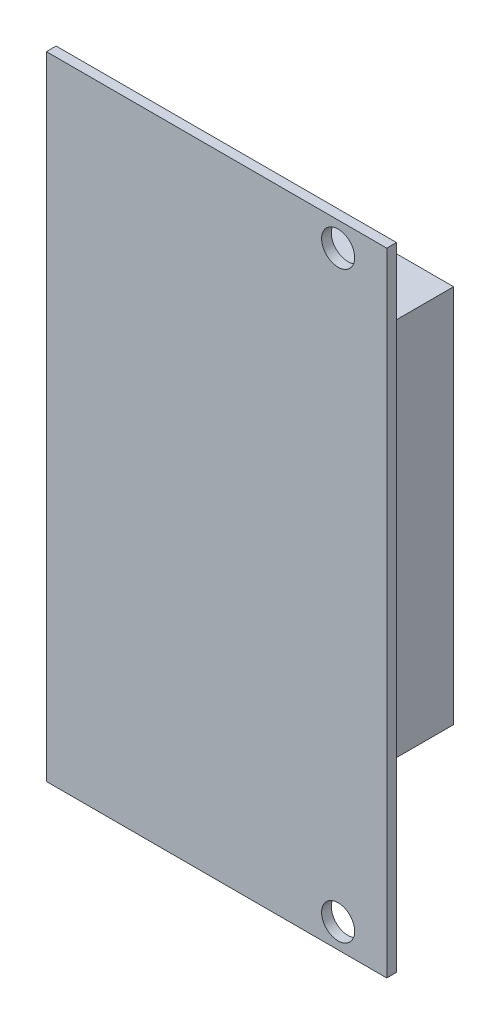
from build123d import *

# Parameters (mm, degrees)
SKETCH1_W                           = 35
SKETCH1_H                           = 65
BOSS_EXTRUDE1_DEPTH                 = 1
SKETCH2_W                           = 22.75
SKETCH2_H                           = 39
BOSS_EXTRUDE2_DEPTH                 = 13
HAI_LO_M3_TRUNG_TRU_TREO_DEPTH      = 40.134383859
HAI_LO_M3_TRUNG_TRU_TREO_DEPTH_BACK = 40.134383859
SKETCH4_R                           = 1.7


with BuildPart() as part:
    # Sketch1 → Boss-Extrude1 (new body)
    with BuildSketch(Plane.XY):
        Rectangle(SKETCH1_W, SKETCH1_H)
    extrude(amount=-BOSS_EXTRUDE1_DEPTH)

    # Sketch2 → Boss-Extrude2 (add)
    with BuildSketch(Plane.XY):
        Rectangle(SKETCH2_W, SKETCH2_H)
    extrude(amount=-BOSS_EXTRUDE2_DEPTH)

    # Sketch4 → Hai_lo_M3_trung_tru_treo (cut, two sides: drawn at the far end of the back side and taken through both)
    with BuildSketch(Plane.XY.offset(-HAI_LO_M3_TRUNG_TRU_TREO_DEPTH_BACK)):
        with Locations(Location((12.5, -30, 0), (0, 0, 180))):
            Circle(SKETCH4_R)
        with Locations(Location((12.5, 30, 0), (0, 0, 180))):
            Circle(SKETCH4_R)
    extrude(amount=HAI_LO_M3_TRUNG_TRU_TREO_DEPTH + HAI_LO_M3_TRUNG_TRU_TREO_DEPTH_BACK, mode=Mode.SUBTRACT)


solid = part.part
